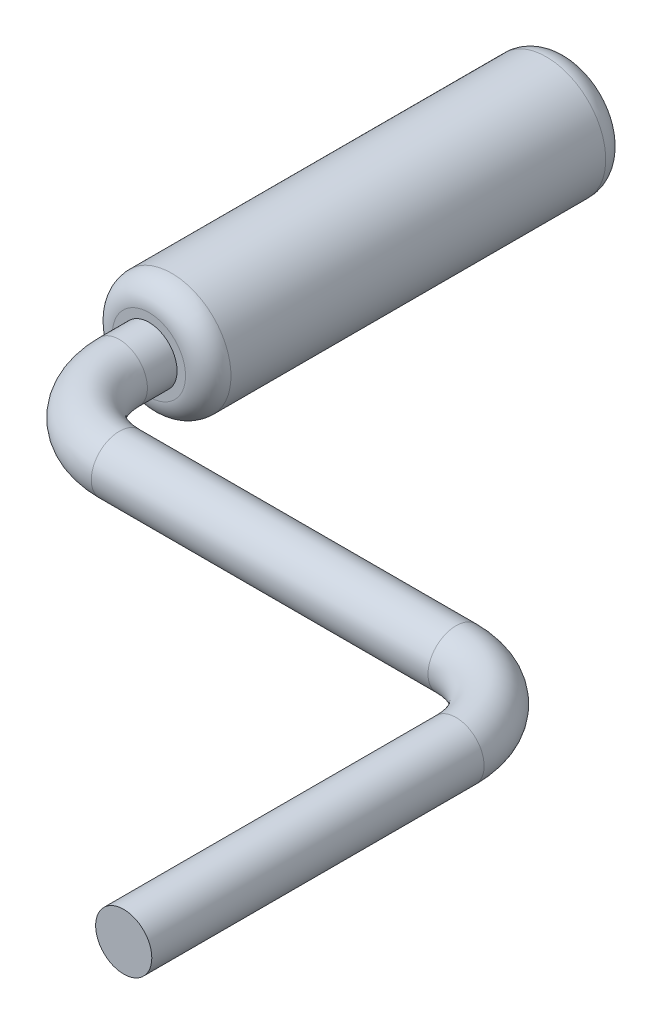
from build123d import *

# Parameters (mm, degrees)
SKETCH2_R           = 6.281650674
SKETCH3_R           = 13.256970647
BOSS_EXTRUDE2_DEPTH = 93.98
FILLET1_R           = 5.08


with BuildPart() as part:
    # Sweep1: sweep along a curve in space
    with BuildLine() as sweep1_path:
        Line((-101.863707381, 710.985218526, -786.864459981), (-101.863707381, 710.985218526, -861.202210018))
        ThreePointArc((-101.863707381, 710.985218526, -861.202210018), (-107.071348812, 710.985218526, -873.774568588), (-119.643707381, 710.985218526, -878.982210018))
        Line((-119.643707381, 710.985218526, -878.982210018), (-194.958974291, 710.985218526, -878.982210018))
        ThreePointArc((-194.958974291, 710.985218526, -878.982210018), (-207.531332861, 710.985218526, -884.189851449), (-212.738974291, 710.985218526, -896.762210018))
        Line((-212.738974291, 710.985218526, -896.762210018), (-212.738974291, 710.985218526, -997.376214376))
    # Sketch2 → Sweep1 (sweep)
    with BuildSketch(Plane(origin=(-212.738974291, 710.985218526, -997.376214376), x_dir=(-1, 0, 0), z_dir=(0, 0, -1))):
        Circle(SKETCH2_R)
    sweep(path=sweep1_path.line)

    # Sketch3 → Boss-Extrude2 (add)
    with BuildSketch(Plane(origin=(0, 0, -997.376214376), x_dir=(-1, 0, 0), z_dir=(0, 0, -1))):
        with Locations((212.738974291, 710.985218526)):
            Circle(SKETCH3_R)
    extrude(amount=-BOSS_EXTRUDE2_DEPTH)

    # Fillet1
    fillet1_edges = [part.edges().sort_by_distance(p)[0] for p in [
        (-199.482003644, 710.985218526, -903.396214376),
        (-199.482003644, 710.985218526, -997.376214376),
    ]]
    fillet(fillet1_edges, radius=FILLET1_R)


solid = part.part
